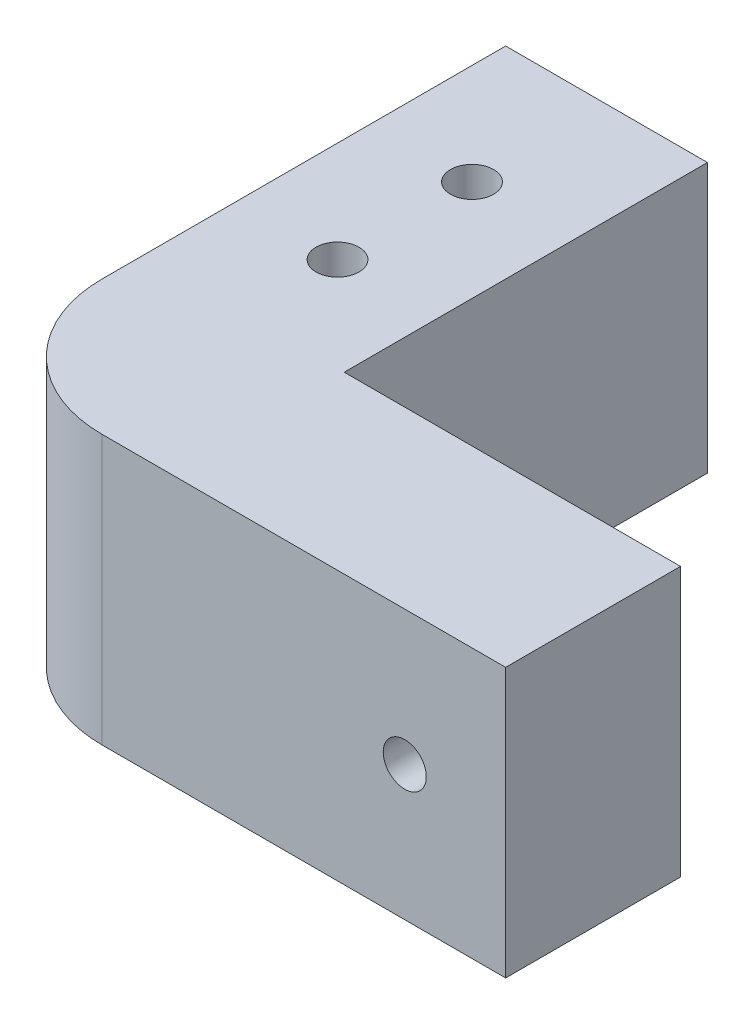
from build123d import *

# Parameters (mm, degrees)
SKETCH_1_W          = 40
SKETCH_1_H          = 40
SKETCH_1_R          = 1.6
EXTRUDE_1_DEPTH     = 20
SKETCH_2_R          = 1.6
CUT_EXTRUDE_1_DEPTH = 61
SKETCH_3_W          = 25
SKETCH_3_H          = 20
CUT_EXTRUDE_2_DEPTH = 27
FILLET_1_R          = 10


with BuildPart() as part:
    # 草图1 → 凸台-拉伸1 (new body)
    with BuildSketch(Plane(origin=(0, 0, 0), x_dir=(1, 0, 0), z_dir=(0, 1, 0))):
        with Locations((20, 20)):
            Rectangle(SKETCH_1_W, SKETCH_1_H)
        with Locations(Location((7.5, 30, 0), (0, 0, 270))):
            Circle(SKETCH_1_R, mode=Mode.SUBTRACT)
        with Locations(Location((7.5, 20, 0), (0, 0, 270))):
            Circle(SKETCH_1_R, mode=Mode.SUBTRACT)
    extrude(amount=EXTRUDE_1_DEPTH)

    # 草图2 → 切除-拉伸1 (cut, through all)
    with BuildSketch(Plane(origin=(0, 0, -40), x_dir=(-1, 0, 0), z_dir=(0, 0, -1))):
        with Locations((-32.5, 10)):
            Circle(SKETCH_2_R)
    extrude(amount=-CUT_EXTRUDE_1_DEPTH, mode=Mode.SUBTRACT)

    # 草图3 → 切除-拉伸2 (cut)
    with BuildSketch(Plane(origin=(0, 0, -40), x_dir=(-1, 0, 0), z_dir=(0, 0, -1))):
        with Locations((-27.5, 10)):
            Rectangle(SKETCH_3_W, SKETCH_3_H)
    extrude(amount=-CUT_EXTRUDE_2_DEPTH, mode=Mode.SUBTRACT)

    # 圆角1
    fillet_1_edges = [part.edges().sort_by_distance(p)[0] for p in [
        (0, 10, 0),
    ]]
    fillet(fillet_1_edges, radius=FILLET_1_R)


solid = part.part
